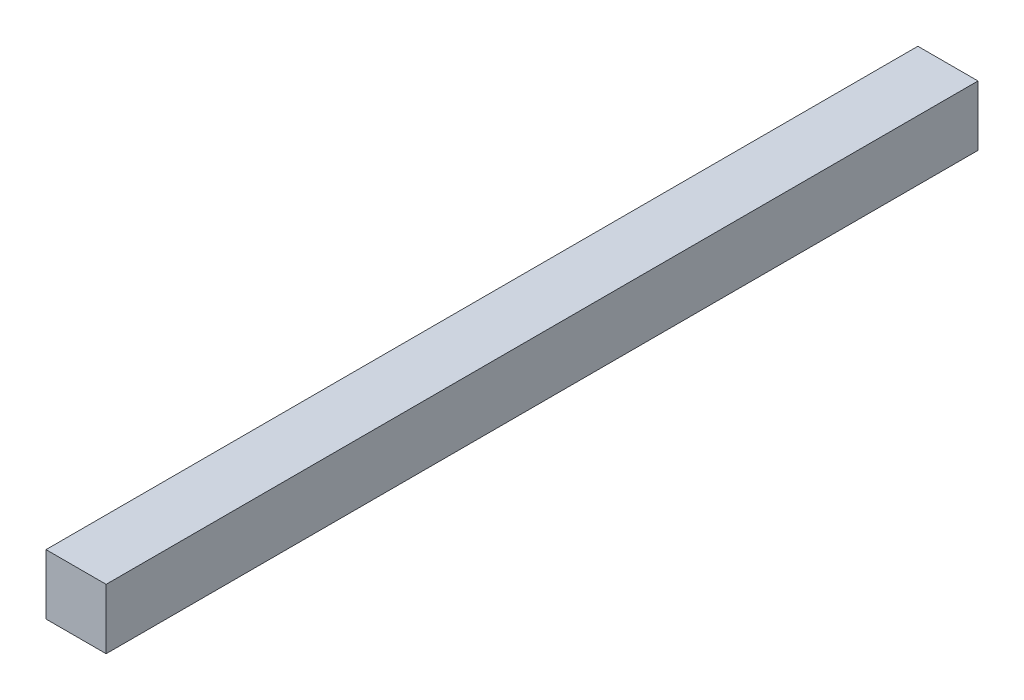
from build123d import *

# Parameters (mm, degrees)
SKETCH1_W           = 20
SKETCH1_H           = 20
BOSS_EXTRUDE1_DEPTH = 290


with BuildPart() as part:
    # Sketch1 → Boss-Extrude1 (new body)
    with BuildSketch(Plane.XY):
        Rectangle(SKETCH1_W, SKETCH1_H)
    extrude(amount=BOSS_EXTRUDE1_DEPTH)


solid = part.part
